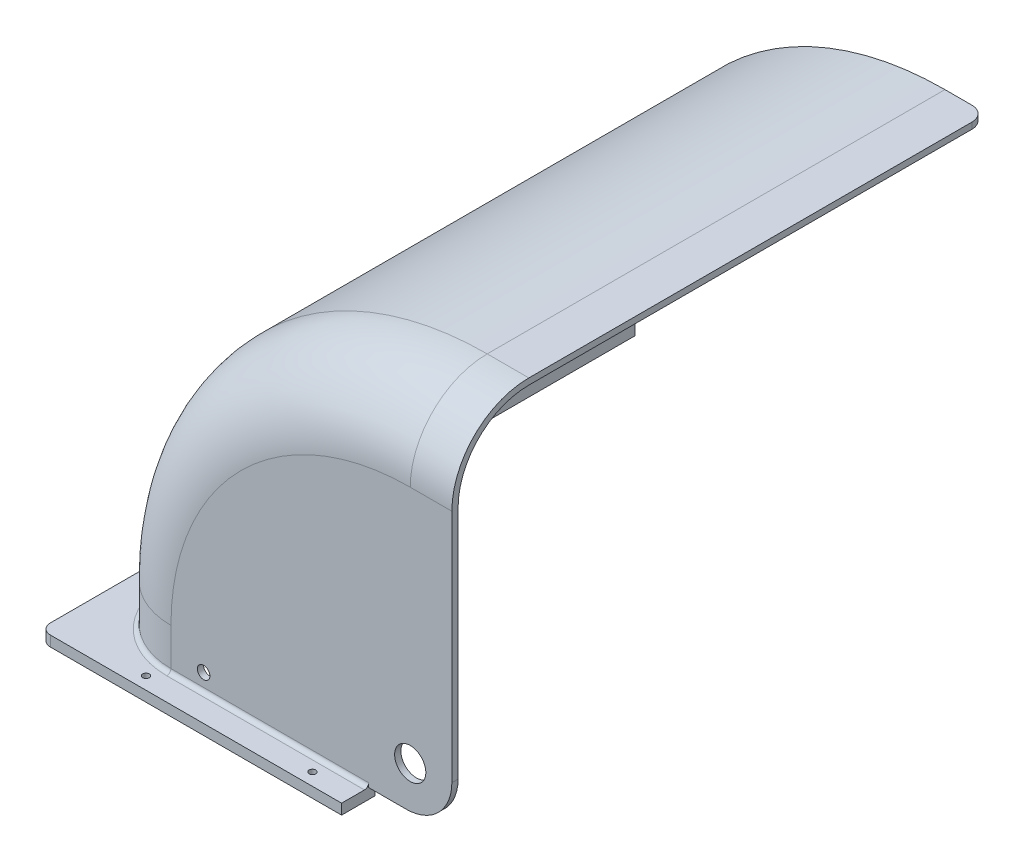
from build123d import *

# Parameters (mm, degrees)
SKETCH1_R           = 1.6
BOSS_EXTRUDE1_DEPTH = 5
BOSS_EXTRUDE5_DEPTH = 20
FILLET8_R           = 34
FILLET9_R           = 37
REVOLVE4_ANGLE      = 90
BOSS_EXTRUDE6_DEPTH = 20
CUT_EXTRUDE3_REACH  = 593.738
SKETCH16_W          = 40
SKETCH16_H          = 5
FILLET10_R          = 22
CUT_EXTRUDE4_REACH  = 581.899
SKETCH17_R          = 7.5
FILLET11_R          = 5
FILLET12_R          = 2
CUT_EXTRUDE5_REACH  = 581.899
SKETCH18_R          = 3
SKETCH19_W          = 201.306473633
SKETCH19_H          = 285.537776223
CUT_EXTRUDE6_DEPTH  = 269
FILLET13_R          = 7


with BuildPart() as part:
    # Sketch1 → Boss-Extrude1 (new body)
    with BuildSketch(Plane(origin=(0, 0, 0), x_dir=(1, 0, 0), z_dir=(0, 1, 0))):
        Polygon((-165, 270), (-165, -270), (0, -270), (0, -254), (-149, -254), (-149, 254), (0, 254), (0, 270), align=None)
        with Locations(Location((-159, 130, 0), (0, 0, 270))):
            Circle(SKETCH1_R, mode=Mode.SUBTRACT)
        with Locations(Location((-159, 50, 0), (0, 0, 270))):
            Circle(SKETCH1_R, mode=Mode.SUBTRACT)
        with Locations(Location((-120, 264, 0), (0, 0, 270))):
            Circle(SKETCH1_R, mode=Mode.SUBTRACT)
        with Locations(Location((-40, 264, 0), (0, 0, 270))):
            Circle(SKETCH1_R, mode=Mode.SUBTRACT)
        with Locations(Location((-159, 210, 0), (0, 0, 270))):
            Circle(SKETCH1_R, mode=Mode.SUBTRACT)
        with Locations(Location((-40, -264, 0), (0, 0, 90))):
            Circle(SKETCH1_R, mode=Mode.SUBTRACT)
        with Locations(Location((-120, -264, 0), (0, 0, 90))):
            Circle(SKETCH1_R, mode=Mode.SUBTRACT)
        with Locations(Location((-159, -210, 0), (0, 0, 90))):
            Circle(SKETCH1_R, mode=Mode.SUBTRACT)
        with Locations(Location((-159, -50, 0), (0, 0, 90))):
            Circle(SKETCH1_R, mode=Mode.SUBTRACT)
        with Locations(Location((-159, -130, 0), (0, 0, 90))):
            Circle(SKETCH1_R, mode=Mode.SUBTRACT)
    extrude(amount=BOSS_EXTRUDE1_DEPTH)

    # Sketch12 → Boss-Extrude5 (add)
    with BuildSketch(Plane(origin=(0, 5, 0), x_dir=(1, 0, 0), z_dir=(0, 1, 0))):
        Polygon((0, 254), (-149, 254), (-149, -254), (0, -254), (0, -257), (-152, -257), (-152, 257), (0, 257), align=None)
    extrude(amount=BOSS_EXTRUDE5_DEPTH)

    # Fillet8
    fillet8_edges = [part.edges().sort_by_distance(p)[0] for p in [
        (-149, 12.5, -254),
        (-149, 12.5, 254),
    ]]
    fillet(fillet8_edges, radius=FILLET8_R)

    # Fillet9
    fillet9_edges = [part.edges().sort_by_distance(p)[0] for p in [
        (-152, 15, -257),
        (-152, 15, 257),
    ]]
    fillet(fillet9_edges, radius=FILLET9_R)

    # Sketch13 → Revolve4 (revolve)
    with BuildSketch(Plane(origin=(0, 25, 0), x_dir=(1, 0, 0), z_dir=(0, 1, 0))):
        with BuildLine():
            Line((0, 254), (-115, 254))
            ThreePointArc((-115, 254), (-139.04163056, 244.04163056), (-149, 220))
            Line((-149, 220), (-149, -220))
            ThreePointArc((-149, -220), (-139.04163056, -244.04163056), (-115, -254))
            Line((-115, -254), (0, -254))
            Line((0, -254), (0, -257))
            Line((0, -257), (-115, -257))
            ThreePointArc((-115, -257), (-141.162950904, -246.162950904), (-152, -220))
            Line((-152, -220), (-152, 220))
            ThreePointArc((-152, 220), (-141.162950904, 246.162950904), (-115, 257))
            Line((-115, 257), (0, 257))
            Line((0, 257), (0, 254))
        make_face()
    revolve(axis=Axis((0, 25, -257), (0, 0, -1)), revolution_arc=REVOLVE4_ANGLE)

    # Sketch15 → Boss-Extrude6 (add)
    with BuildSketch(Plane(origin=(0, 0, 0), x_dir=(0, 0, -1), z_dir=(1, 0, 0))):
        with BuildLine():
            Line((-254, 5), (-254, 140))
            ThreePointArc((-254, 140), (-244.04163056, 164.04163056), (-220, 174))
            Line((-220, 174), (220, 174))
            ThreePointArc((220, 174), (244.04163056, 164.04163056), (254, 140))
            Line((254, 140), (254, 5))
            Line((254, 5), (254, 0))
            Line((254, 0), (270, 0))
            Line((270, 0), (270, 5))
            Line((270, 5), (257, 5))
            Line((257, 5), (257, 140))
            ThreePointArc((257, 140), (246.162950904, 166.162950904), (220, 177))
            Line((220, 177), (-220, 177))
            ThreePointArc((-220, 177), (-246.162950904, 166.162950904), (-257, 140))
            Line((-257, 140), (-257, 5))
            Line((-257, 5), (-270, 5))
            Line((-270, 5), (-270, 0))
            Line((-270, 0), (-254, 0))
            Line((-254, 0), (-254, 5))
        make_face()
    extrude(amount=BOSS_EXTRUDE6_DEPTH)

    # Cut-Extrude3: up to this face of the body (flat: up to its plane)
    cut_extrude3_end = Plane(part.part.faces().sort_by_distance((-72.5, 2.5, -270))[0])
    # Sketch16 → Cut-Extrude3 (cut, up to the picked face)
    with BuildSketch(Plane.XY.offset(270), mode=Mode.PRIVATE) as cut_extrude3_sk1:
        with Locations((0, 2.5)):
            Rectangle(SKETCH16_W, SKETCH16_H)
    cut_extrude3_tool1 = split(extrude(cut_extrude3_sk1.sketch, amount=-CUT_EXTRUDE3_REACH, mode=Mode.PRIVATE), bisect_by=cut_extrude3_end, keep=Keep.BOTH, mode=Mode.PRIVATE)
    add(cut_extrude3_tool1.solids().sort_by(Axis((0, 2.5, 270), (0, 0, -1)))[0], mode=Mode.SUBTRACT)

    # Fillet10
    fillet10_edges = [part.edges().sort_by_distance(p)[0] for p in [
        (20, 5, 255.5),
        (20, 5, -255.5),
    ]]
    fillet(fillet10_edges, radius=FILLET10_R)

    # Cut-Extrude4: up to this face of the body (flat: up to its plane)
    cut_extrude4_end = Plane(part.part.faces().sort_by_distance((-40.16059182, 65.16059182, -257))[0])
    # Sketch17 → Cut-Extrude4 (cut, up to the picked face)
    with BuildSketch(Plane.XY.offset(257), mode=Mode.PRIVATE) as cut_extrude4_sk1:
        with Locations((0, 25)):
            Circle(SKETCH17_R)
    cut_extrude4_tool1 = split(extrude(cut_extrude4_sk1.sketch, amount=-CUT_EXTRUDE4_REACH, mode=Mode.PRIVATE), bisect_by=cut_extrude4_end, keep=Keep.BOTH, mode=Mode.PRIVATE)
    add(cut_extrude4_tool1.solids().sort_by(Axis((0, 25, 257), (0, 0, -1)))[0], mode=Mode.SUBTRACT)

    # Fillet11
    fillet11_edges = [part.edges().sort_by_distance(p)[0] for p in [
        (-165, 2.5, 270),
        (-165, 2.5, -270),
    ]]
    fillet(fillet11_edges, radius=FILLET11_R)

    # Fillet12
    fillet12_edges = [part.edges().sort_by_distance(p)[0] for p in [
        (-152, 5, 0),
        (-67.5, 5, 257),
        (-141.162950904, 5, -246.162950904),
        (-141.162950904, 5, 246.162950904),
        (-67.5, 5, -257),
    ]]
    fillet(fillet12_edges, radius=FILLET12_R)

    # Cut-Extrude5: up to this face of the body (flat: up to its plane)
    cut_extrude5_end = Plane(part.part.faces().sort_by_distance((-40.288135092, 66.389949232, 257))[0])
    # Sketch18 → Cut-Extrude5 (cut, up to the picked face)
    with BuildSketch(Plane(origin=(0, 0, -257), x_dir=(-1, 0, 0), z_dir=(0, 0, -1)), mode=Mode.PRIVATE) as cut_extrude5_sk1:
        with Locations((99.306112319, 13.240065646)):
            Circle(SKETCH18_R)
    cut_extrude5_tool1 = split(extrude(cut_extrude5_sk1.sketch, amount=-CUT_EXTRUDE5_REACH, mode=Mode.PRIVATE), bisect_by=cut_extrude5_end, keep=Keep.BOTH, mode=Mode.PRIVATE)
    add(cut_extrude5_tool1.solids().sort_by(Axis((-99.306112, 13.240066, -257), (0, 0, 1)))[0], mode=Mode.SUBTRACT)

    # Sketch19 → Cut-Extrude6 (cut)
    with BuildSketch(Plane.XZ):
        with Locations((-80.653236817, -142.768888112)):
            Rectangle(SKETCH19_W, SKETCH19_H)
    extrude(amount=-CUT_EXTRUDE6_DEPTH, mode=Mode.SUBTRACT)

    # Fillet13
    fillet13_edges = [part.edges().sort_by_distance(p)[0] for p in [
        (20, 175.5, 0),
    ]]
    fillet(fillet13_edges, radius=FILLET13_R)


solid = part.part
